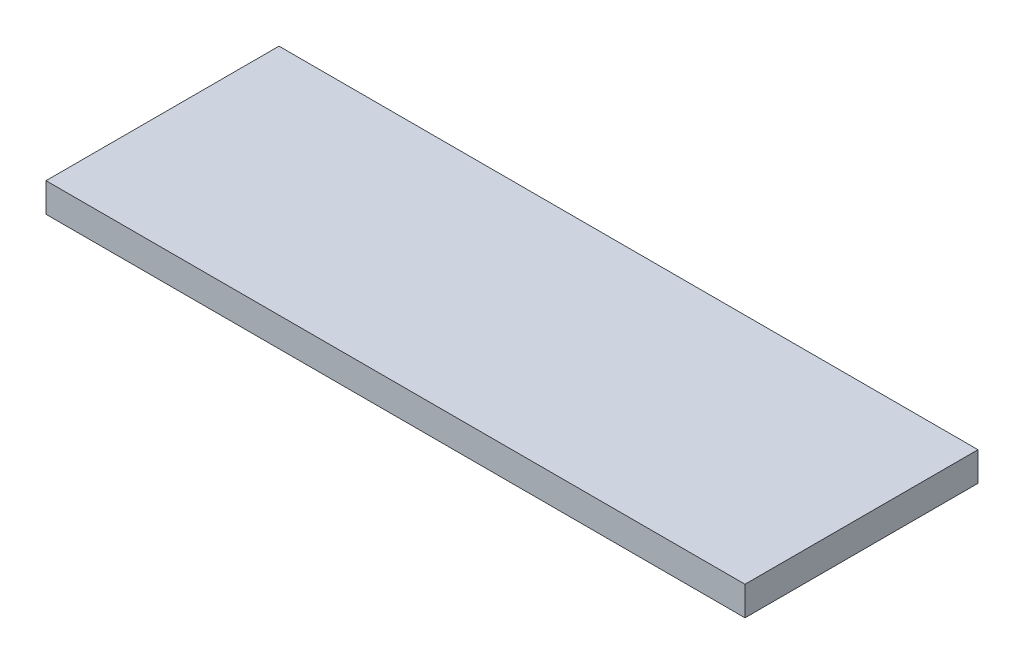
from build123d import *

# Parameters (mm, degrees)
SZKIC1_W                    = 6
SZKIC1_H                    = 2
DODANIE_WYCI_GNI_CIE1_DEPTH = 0.25


with BuildPart() as part:
    # Szkic1 → Dodanie-wyciągnięcie1 (new body)
    with BuildSketch(Plane(origin=(0, 0, 0), x_dir=(1, 0, 0), z_dir=(0, 1, 0))):
        with Locations((-0.022135115, -0.000122487)):
            Rectangle(SZKIC1_W, SZKIC1_H)
    extrude(amount=DODANIE_WYCI_GNI_CIE1_DEPTH)


solid = part.part
